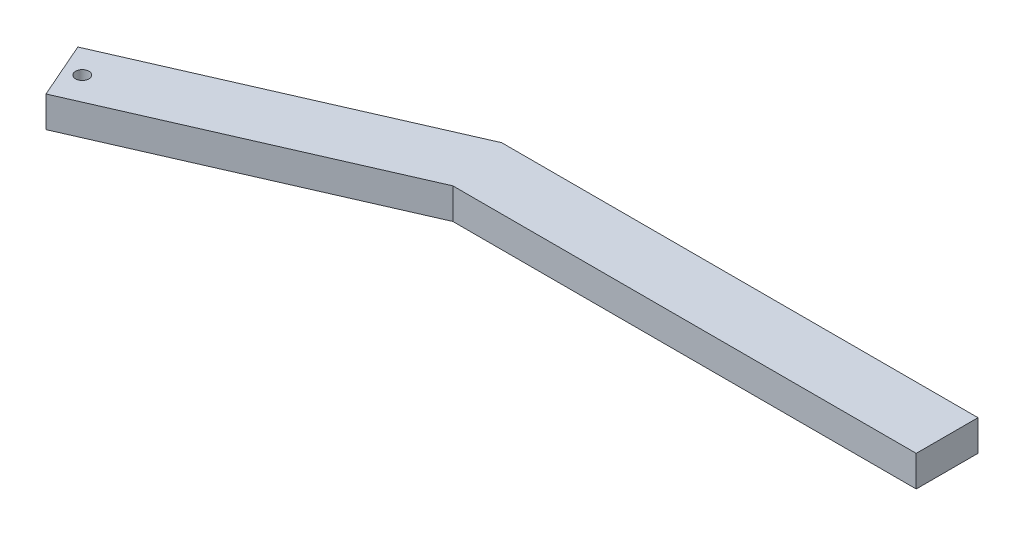
from build123d import *

# Parameters (mm, degrees)
BOSS_EXTRUDE1_DEPTH                                  = 25.4
CSK_FOR_M10_COUNTERSUNK_FLAT_HEAD_SCREW1_D           = 11
CSK_FOR_M10_COUNTERSUNK_FLAT_HEAD_SCREW1_CSINK_D     = 20
CSK_FOR_M10_COUNTERSUNK_FLAT_HEAD_SCREW1_CSINK_ANGLE = 90


with BuildPart() as part:
    # Sketch1 → Boss-Extrude1 (new body)
    with BuildSketch(Plane(origin=(0, 0, 0), x_dir=(1, 0, 0), z_dir=(0, 1, 0))):
        Polygon((0, 0), (242.421488875, 106.122270026), (634.05352485, 106.122270026), (634.05352485, 55.322270026), (253.05352485, 55.322270026), (20.371725961, -46.536359778), align=None)
    extrude(amount=BOSS_EXTRUDE1_DEPTH)

    # CSK for M10 Countersunk Flat Head Screw1 (through all)
    with Locations(Plane.XZ):
        with Locations((21.819952925, 18.175248399)):
            CounterSinkHole(CSK_FOR_M10_COUNTERSUNK_FLAT_HEAD_SCREW1_D / 2, CSK_FOR_M10_COUNTERSUNK_FLAT_HEAD_SCREW1_CSINK_D / 2, counter_sink_angle=CSK_FOR_M10_COUNTERSUNK_FLAT_HEAD_SCREW1_CSINK_ANGLE)


solid = part.part
